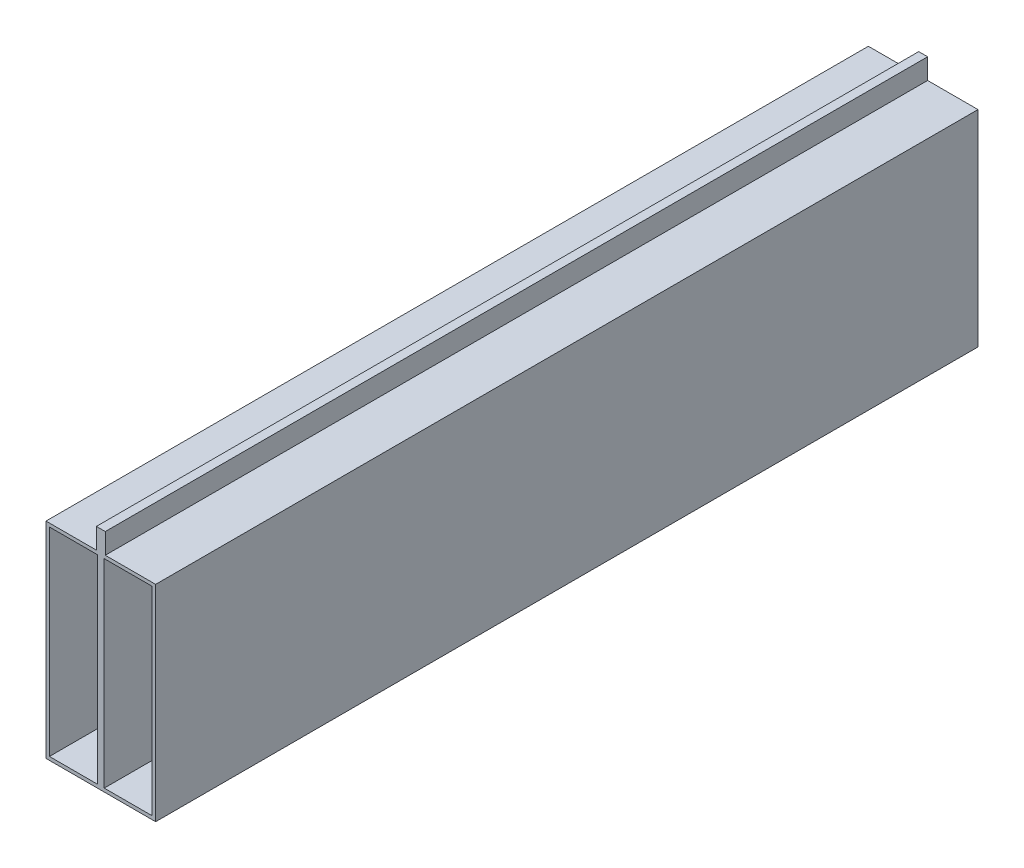
from build123d import *

# Parameters (mm, degrees)
ESQUISSE1_W        = 800
ESQUISSE1_H        = 1500
ESQUISSE1_W_2      = 350
ESQUISSE1_H_2      = 1450
BOSS_EXTRU_1_DEPTH = 6000
ESQUISSE2_W        = 65
ESQUISSE2_H        = 150
BOSS_EXTRU_2_DEPTH = 6000


with BuildPart() as part:
    # Esquisse1 → Boss.-Extru.1 (new body)
    with BuildSketch(Plane.XY):
        with Locations((400, 750)):
            Rectangle(ESQUISSE1_W, ESQUISSE1_H)
        with Locations((600, 750)):
            Rectangle(ESQUISSE1_W_2, ESQUISSE1_H_2, mode=Mode.SUBTRACT)
        with Locations((200, 750)):
            Rectangle(ESQUISSE1_W_2, ESQUISSE1_H_2, mode=Mode.SUBTRACT)
    extrude(amount=-BOSS_EXTRU_1_DEPTH)

    # Esquisse2 → Boss.-Extru.2 (add)
    with BuildSketch(Plane.XY):
        with Locations((400, 1575)):
            Rectangle(ESQUISSE2_W, ESQUISSE2_H)
    extrude(amount=-BOSS_EXTRU_2_DEPTH)


solid = part.part
